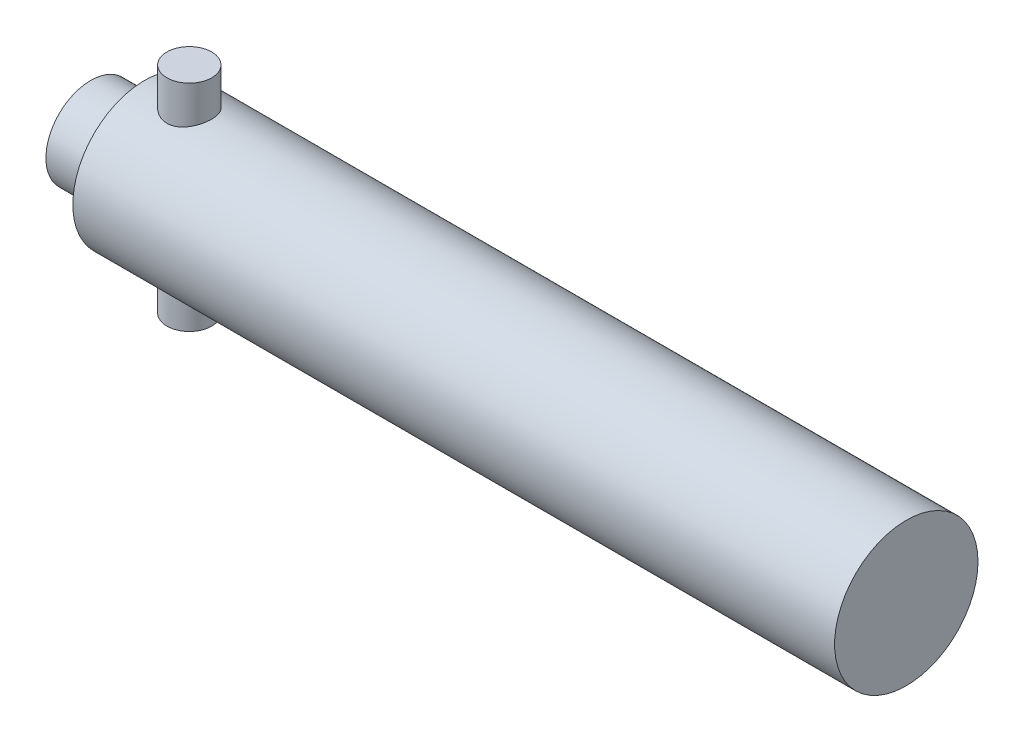
from build123d import *

# Parameters (mm, degrees)
SKETCH1_R           = 101.6
BOSS_EXTRUDE1_DEPTH = 539.75
SKETCH2_R           = 31.75
BOSS_EXTRUDE2_DEPTH = 152.4
SKETCH3_R           = 63.5
BOSS_EXTRUDE3_DEPTH = 76.2


with BuildPart() as part:
    # Sketch1 → Boss-Extrude1 (new, symmetric)
    with BuildSketch(Plane(origin=(0, 0, 0), x_dir=(0, 0, -1), z_dir=(1, 0, 0))):
        Circle(SKETCH1_R)
    extrude(amount=BOSS_EXTRUDE1_DEPTH, both=True)

    # Sketch2 → Boss-Extrude2 (add, symmetric)
    with BuildSketch(Plane(origin=(0, 0, 0), x_dir=(1, 0, 0), z_dir=(0, 1, 0))):
        with Locations(Location((-476.25, 0, 0), (0, 0, 90))):
            Circle(SKETCH2_R)
    extrude(amount=BOSS_EXTRUDE2_DEPTH, both=True)

    # Sketch3 → Boss-Extrude3 (add)
    with BuildSketch(Plane.ZY.offset(539.75)):
        with Locations(Location((0, 0, 0), (0, 0, 180))):
            Circle(SKETCH3_R)
    extrude(amount=BOSS_EXTRUDE3_DEPTH)


solid = part.part
